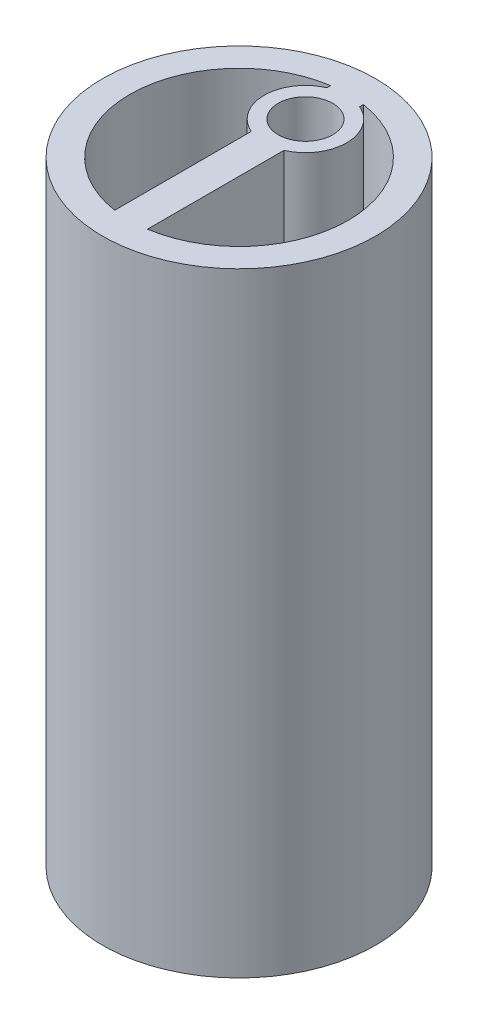
from build123d import *

# Parameters (mm, degrees)
SKETCH1_R           = 10
SKETCH1_R_2         = 8
BOSS_EXTRUDE1_DEPTH = 45
SKETCH3_W           = 2.4
SKETCH3_H           = 17.997909017
BOSS_EXTRUDE3_DEPTH = 45
SKETCH4_R           = 3.019619096
BOSS_EXTRUDE4_DEPTH = 45
SKETCH5_R           = 2
CUT_EXTRUDE1_DEPTH  = 48.16990566


with BuildPart() as part:
    # Sketch1 → Boss-Extrude1 (new body)
    with BuildSketch(Plane(origin=(0, 0, 0), x_dir=(1, 0, 0), z_dir=(0, 1, 0))):
        with Locations(Location((0, 0, 0), (0, 0, 90))):
            Circle(SKETCH1_R)
        with Locations(Location((0, 0, 0), (0, 0, 90))):
            Circle(SKETCH1_R_2, mode=Mode.SUBTRACT)
    extrude(amount=BOSS_EXTRUDE1_DEPTH)

    # Sketch3 → Boss-Extrude3 (add, through all)
    with BuildSketch(Plane(origin=(0, 45, 0), x_dir=(1, 0, 0), z_dir=(0, 1, 0))):
        with Locations((0, -0.005799161)):
            Rectangle(SKETCH3_W, SKETCH3_H)
    extrude(amount=-BOSS_EXTRUDE3_DEPTH)

    # Sketch4 → Boss-Extrude4 (add, through all)
    with BuildSketch(Plane(origin=(0, 45, 0), x_dir=(1, 0, 0), z_dir=(0, 1, 0))):
        with Locations((0, 4.86415262)):
            Circle(SKETCH4_R)
    extrude(amount=-BOSS_EXTRUDE4_DEPTH)

    # Sketch5 → Cut-Extrude1 (cut, through all)
    with BuildSketch(Plane(origin=(0, 45, 0), x_dir=(1, 0, 0), z_dir=(0, 1, 0))):
        with Locations(Location((0, 4.86415262, 0), (0, 0, 270))):
            Circle(SKETCH5_R)
    extrude(amount=-CUT_EXTRUDE1_DEPTH, mode=Mode.SUBTRACT)


solid = part.part
